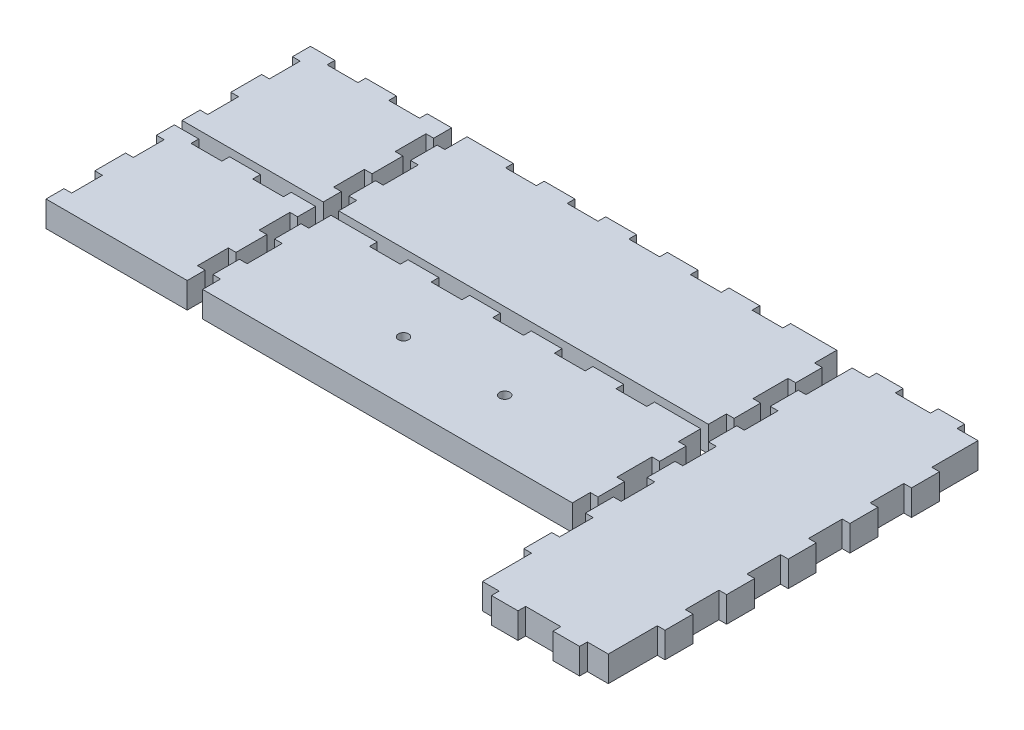
from build123d import *

# Parameters (mm, degrees)
BOSS_EXTRUDE1_DEPTH   = 10
BOSS_EXTRUDE1_2_DEPTH = 10
BOSS_EXTRUDE1_3_DEPTH = 10
BOSS_EXTRUDE1_4_DEPTH = 10
BOSS_EXTRUDE1_5_DEPTH = 10
SKETCH2_R             = 1.997822351
SKETCH2_R_2           = 2.000000328
CUT_EXTRUDE1_DEPTH    = 186.328261156


with BuildPart() as part:
    # Sketch1 → Boss-Extrude1 (new body)
    with BuildSketch(Plane(origin=(0, 0, 0), x_dir=(1, 0, 0), z_dir=(0, 1, 0))):
        Polygon((-32.812912017, 122.703686357), (-20.812911913, 122.703686357), (-20.812911913, 125.703692436), (-8.812911808, 125.703692436), (-8.812911808, 122.703686357), (3.187088063, 122.703686357), (3.187088063, 125.703692436), (15.1870884, 125.703692436), (15.1870884, 122.703686357), (27.187088504, 122.703686357), (27.187088504, 125.703692436), (39.187088609, 125.703692436), (39.187088609, 122.703686357), (51.18708685, 122.703686357), (51.18708685, 125.703692436), (69.187089801, 125.703692436), (69.187089801, 122.703686357), (69.187089801, 117.03671515), (72.18708843, 117.03671515), (72.18708843, 106.703691185), (69.187089801, 106.703691185), (69.187089801, 93.036711216), (72.18708843, 93.036711216), (72.18708843, 82.703687251), (69.187089801, 82.703687251), (69.187089801, 75.703687966), (-74.812911451, 75.703687966), (-74.812911451, 82.703687251), (-77.81291008, 82.703687251), (-77.81291008, 93.036711216), (-74.812911451, 93.036711216), (-74.812911451, 106.703691185), (-77.81291008, 106.703691185), (-77.81291008, 117.03671515), (-74.812911451, 117.03671515), (-74.812911451, 122.703686357), (-74.812911451, 125.703692436), (-56.812912226, 125.703692436), (-56.812912226, 122.703686357), (-44.812910259, 122.703686357), (-44.812910259, 125.703692436), (-32.812912017, 125.703692436), align=None)
    extrude(amount=BOSS_EXTRUDE1_DEPTH)


with BuildPart() as body_2:
    # Sketch1 → Boss-Extrude1 2 (new body)
    with BuildSketch(Plane(origin=(0, 0, 0), x_dir=(1, 0, 0), z_dir=(0, 1, 0))):
        Polygon((-135.812908411, 125.703692436), (-126.31291151, 125.703692436), (-126.31291151, 122.703686357), (-114.312909544, 122.703686357), (-114.312909544, 125.703692436), (-102.312915027, 125.703692436), (-102.312915027, 122.703686357), (-90.31291306, 122.703686357), (-90.31291306, 125.703692436), (-80.812908709, 125.703692436), (-80.812908709, 122.703686357), (-80.812908709, 118.703693151), (-83.812914789, 118.703693151), (-83.812914789, 106.703691185), (-80.812908709, 106.703691185), (-80.812908709, 94.703689218), (-83.812914789, 94.703689218), (-83.812914789, 82.703687251), (-80.812908709, 82.703687251), (-80.812908709, 75.703687966), (-135.812908411, 75.703687966), (-135.812908411, 82.703687251), (-132.812917233, 82.703687251), (-132.812917233, 94.703689218), (-135.812908411, 94.703689218), (-135.812908411, 106.703691185), (-132.812917233, 106.703691185), (-132.812917233, 118.703693151), (-135.812908411, 118.703693151), (-135.812908411, 122.703686357), align=None)
    extrude(amount=BOSS_EXTRUDE1_2_DEPTH)


with BuildPart() as body_3:
    # Sketch1 → Boss-Extrude1 3 (new body)
    with BuildSketch(Plane(origin=(0, 0, 0), x_dir=(1, 0, 0), z_dir=(0, 1, 0))):
        Polygon((-135.812908411, 72.703689337), (-126.31291151, 72.703689337), (-126.31291151, 69.703683257), (-114.312909544, 69.703683257), (-114.312909544, 72.703689337), (-102.312915027, 72.703689337), (-102.312915027, 69.703683257), (-90.31291306, 69.703683257), (-90.31291306, 72.703689337), (-80.812908709, 72.703689337), (-80.812908709, 69.703683257), (-80.812908709, 65.703690052), (-83.812914789, 65.703690052), (-83.812914789, 53.703688085), (-80.812908709, 53.703688085), (-80.812908709, 41.703686118), (-83.812914789, 41.703686118), (-83.812914789, 29.703684151), (-80.812908709, 29.703684151), (-80.812908709, 22.703684866), (-135.812908411, 22.703684866), (-135.812908411, 29.703684151), (-132.812917233, 29.703684151), (-132.812917233, 41.703686118), (-135.812908411, 41.703686118), (-135.812908411, 53.703688085), (-132.812917233, 53.703688085), (-132.812917233, 65.703690052), (-135.812908411, 65.703690052), (-135.812908411, 69.703683257), align=None)
    extrude(amount=BOSS_EXTRUDE1_3_DEPTH)


with BuildPart() as body_4:
    # Sketch1 → Boss-Extrude1 4 (new body)
    with BuildSketch(Plane(origin=(0, 0, 0), x_dir=(1, 0, 0), z_dir=(0, 1, 0))):
        Polygon((-32.812912017, 69.703683257), (-20.812911913, 69.703683257), (-20.812911913, 72.703689337), (-8.812911808, 72.703689337), (-8.812911808, 69.703683257), (3.187088063, 69.703683257), (3.187088063, 72.703689337), (15.1870884, 72.703689337), (15.1870884, 69.703683257), (27.187088504, 69.703683257), (27.187088504, 72.703689337), (39.187088609, 72.703689337), (39.187088609, 69.703683257), (51.18708685, 69.703683257), (51.18708685, 72.703689337), (69.187089801, 72.703689337), (69.187089801, 69.703683257), (69.187089801, 64.03671205), (72.18708843, 64.03671205), (72.18708843, 53.703688085), (69.187089801, 53.703688085), (69.187089801, 40.036708117), (72.18708843, 40.036708117), (72.18708843, 29.703684151), (69.187089801, 29.703684151), (69.187089801, 22.703684866), (-74.812911451, 22.703684866), (-74.812911451, 29.703684151), (-77.81291008, 29.703684151), (-77.81291008, 40.036708117), (-74.812911451, 40.036708117), (-74.812911451, 53.703688085), (-77.81291008, 53.703688085), (-77.81291008, 64.03671205), (-74.812911451, 64.03671205), (-74.812911451, 69.703683257), (-74.812911451, 72.703689337), (-56.812912226, 72.703689337), (-56.812912226, 69.703683257), (-44.812910259, 69.703683257), (-44.812910259, 72.703689337), (-32.812912017, 72.703689337), align=None)
    extrude(amount=BOSS_EXTRUDE1_4_DEPTH)

    # Sketch2 → Cut-Extrude1 (cut, through all)
    with BuildSketch(Plane(origin=(0, 10, 0), x_dir=(1, 0, 0), z_dir=(0, 1, 0))):
        with Locations(Location((-19.704415408, 45.837319398, 0), (0, 0, 270))):
            Circle(SKETCH2_R)
        with Locations(Location((19.706618041, 45.84139958, 0), (0, 0, 270))):
            Circle(SKETCH2_R_2)
    extrude(amount=-CUT_EXTRUDE1_DEPTH, mode=Mode.SUBTRACT)


with BuildPart() as body_5:
    # Sketch1 → Boss-Extrude1 5 (new body)
    with BuildSketch(Plane(origin=(0, 0, 0), x_dir=(1, 0, 0), z_dir=(0, 1, 0))):
        Polygon((95.021896064, 122.703686357), (108.687087893, 122.703686357), (108.687087893, 125.703692436), (119.021899998, 125.703692436), (119.021899998, 122.703686357), (127.187088132, 122.703686357), (127.187088132, 104.703687131), (130.187094212, 104.703687131), (130.187094212, 93.799009919), (127.187088132, 93.799009919), (127.187088132, 80.703690648), (130.187094212, 80.703690648), (130.187094212, 69.799013436), (127.187088132, 69.799013436), (127.187088132, 56.703690439), (130.187094212, 56.703690439), (130.187094212, 45.799020678), (127.187088132, 45.799020678), (127.187088132, 32.703690231), (130.187094212, 32.703690231), (130.187094212, 21.799016744), (127.187088132, 21.799016744), (127.187088132, 8.703690022), (130.187094212, 8.703690022), (130.187094212, -2.200983232), (127.187088132, -2.200983232), (127.187088132, -21.29631117), (119.021899998, -21.29631117), (119.021899998, -24.296309799), (108.687087893, -24.296309799), (108.687087893, -21.29631117), (95.021896064, -21.29631117), (95.021896064, -24.296309799), (84.68709141, -24.296309799), (84.68709141, -21.29631117), (78.187085688, -21.29631117), (78.187085688, -2.200983232), (75.187087059, -2.200983232), (75.187087059, 8.703690022), (78.187085688, 8.703690022), (78.187085688, 21.799016744), (75.187087059, 21.799016744), (75.187087059, 32.703690231), (78.187085688, 32.703690231), (78.187085688, 45.799020678), (75.187087059, 45.799020678), (75.187087059, 56.703690439), (78.187085688, 56.703690439), (78.187085688, 69.799013436), (75.187087059, 69.799013436), (75.187087059, 80.703690648), (78.187085688, 80.703690648), (78.187085688, 93.799009919), (75.187087059, 93.799009919), (75.187087059, 104.703687131), (78.187085688, 104.703687131), (78.187085688, 122.703686357), (84.68709141, 122.703686357), (84.68709141, 125.703692436), (95.021896064, 125.703692436), align=None)
    extrude(amount=BOSS_EXTRUDE1_5_DEPTH)


solid = Compound([part.part, body_2.part, body_3.part, body_4.part, body_5.part])
